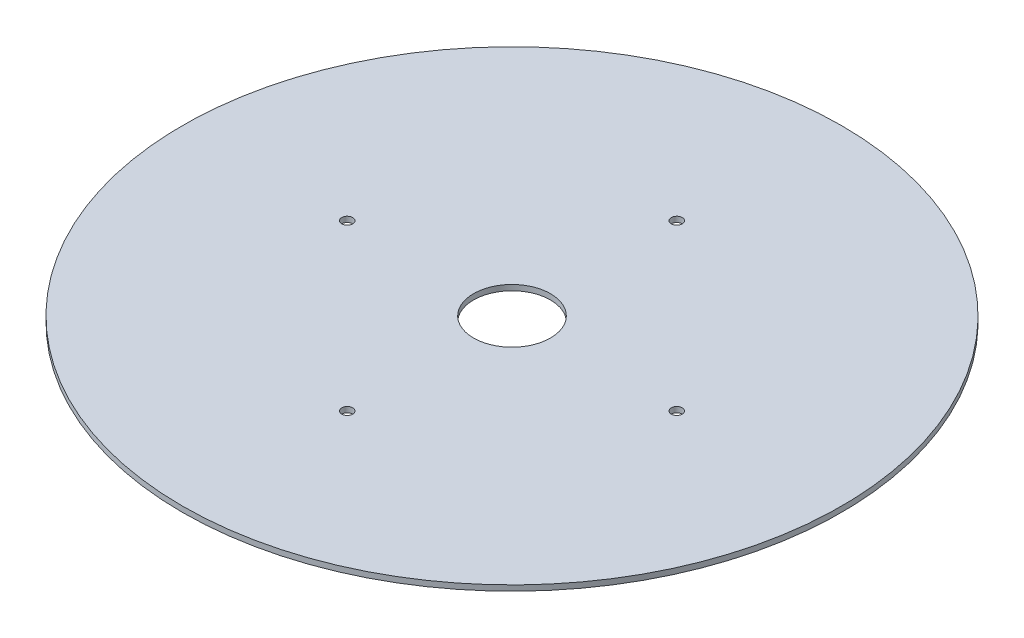
from build123d import *

# Parameters (mm, degrees)
SKETCH3_R           = 150
SKETCH3_R_2         = 17.5
SKETCH3_R_3         = 2.5
BOSS_EXTRUDE1_DEPTH = 2.5


with BuildPart() as part:
    # Sketch3 → Boss-Extrude1 (new body)
    with BuildSketch(Plane(origin=(0, 0, 0), x_dir=(1, 0, 0), z_dir=(0, 1, 0))):
        with Locations(Location((0, 0, 0), (0, 0, 270))):
            Circle(SKETCH3_R)
        with Locations(Location((0, 0, 0), (0, 0, 270))):
            Circle(SKETCH3_R_2, mode=Mode.SUBTRACT)
        with Locations(Location((-75, 0, 0), (0, 0, 270))):
            Circle(SKETCH3_R_3, mode=Mode.SUBTRACT)
        with Locations(Location((0, 75, 0), (0, 0, 270))):
            Circle(SKETCH3_R_3, mode=Mode.SUBTRACT)
        with Locations(Location((75, 0, 0), (0, 0, 270))):
            Circle(SKETCH3_R_3, mode=Mode.SUBTRACT)
        with Locations(Location((0, -75, 0), (0, 0, 270))):
            Circle(SKETCH3_R_3, mode=Mode.SUBTRACT)
    extrude(amount=BOSS_EXTRUDE1_DEPTH)


solid = part.part
